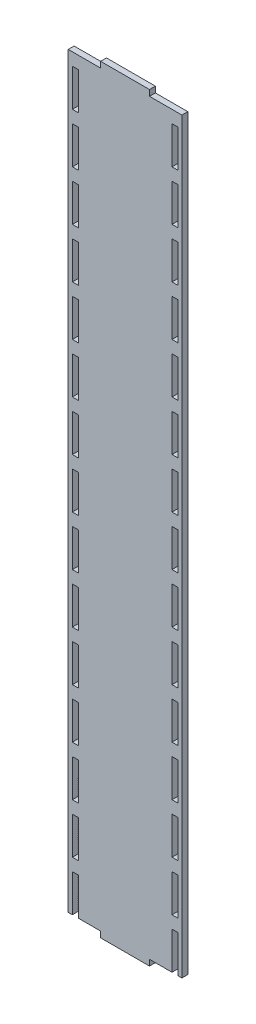
from build123d import *

# Parameters (mm, degrees)
SKETCH1_W           = 2.9972
SKETCH1_H           = 19.05
BOSS_EXTRUDE1_DEPTH = 2.9972


with BuildPart() as part:
    # Sketch1 → Boss-Extrude1 (new body)
    with BuildSketch(Plane.XY):
        Polygon((-12.4968, 0), (-12.4968, -2.9972), (-29.0068, -2.9972), (-29.0068, -383.9972), (-26.8986, -383.9972), (-26.8986, -364.9472), (-23.9014, -364.9472), (-23.9014, -383.9972), (-12.4968, -383.9972), (-12.4968, -386.9944), (12.4206, -386.9944), (12.4206, -383.9972), (23.9014, -383.9972), (23.9014, -364.9472), (26.8986, -364.9472), (26.8986, -383.9972), (28.9306, -383.9972), (28.9306, -2.9972), (12.4206, -2.9972), (12.4206, 0), align=None)
        with Locations((-25.4, -349.0722)):
            Rectangle(SKETCH1_W, SKETCH1_H, mode=Mode.SUBTRACT)
        with Locations((-25.4, -323.6722)):
            Rectangle(SKETCH1_W, SKETCH1_H, mode=Mode.SUBTRACT)
        with Locations((-25.4, -298.2722)):
            Rectangle(SKETCH1_W, SKETCH1_H, mode=Mode.SUBTRACT)
        with Locations((-25.4, -272.8722)):
            Rectangle(SKETCH1_W, SKETCH1_H, mode=Mode.SUBTRACT)
        with Locations((-25.4, -247.4722)):
            Rectangle(SKETCH1_W, SKETCH1_H, mode=Mode.SUBTRACT)
        with Locations((-25.4, -222.0722)):
            Rectangle(SKETCH1_W, SKETCH1_H, mode=Mode.SUBTRACT)
        with Locations((-25.4, -196.6722)):
            Rectangle(SKETCH1_W, SKETCH1_H, mode=Mode.SUBTRACT)
        with Locations((25.4, -349.0722)):
            Rectangle(SKETCH1_W, SKETCH1_H, mode=Mode.SUBTRACT)
        with Locations((25.4, -323.6722)):
            Rectangle(SKETCH1_W, SKETCH1_H, mode=Mode.SUBTRACT)
        with Locations((25.4, -298.2722)):
            Rectangle(SKETCH1_W, SKETCH1_H, mode=Mode.SUBTRACT)
        with Locations((25.4, -272.8722)):
            Rectangle(SKETCH1_W, SKETCH1_H, mode=Mode.SUBTRACT)
        with Locations((25.4, -247.4722)):
            Rectangle(SKETCH1_W, SKETCH1_H, mode=Mode.SUBTRACT)
        with Locations((25.4, -222.0722)):
            Rectangle(SKETCH1_W, SKETCH1_H, mode=Mode.SUBTRACT)
        with Locations((25.4, -196.6722)):
            Rectangle(SKETCH1_W, SKETCH1_H, mode=Mode.SUBTRACT)
        with Locations((-25.4, -171.2722)):
            Rectangle(SKETCH1_W, SKETCH1_H, mode=Mode.SUBTRACT)
        with Locations((-25.4, -145.8722)):
            Rectangle(SKETCH1_W, SKETCH1_H, mode=Mode.SUBTRACT)
        with Locations((-25.4, -120.4722)):
            Rectangle(SKETCH1_W, SKETCH1_H, mode=Mode.SUBTRACT)
        with Locations((-25.4, -95.0722)):
            Rectangle(SKETCH1_W, SKETCH1_H, mode=Mode.SUBTRACT)
        with Locations((-25.4, -69.6722)):
            Rectangle(SKETCH1_W, SKETCH1_H, mode=Mode.SUBTRACT)
        with Locations((-25.4, -44.2722)):
            Rectangle(SKETCH1_W, SKETCH1_H, mode=Mode.SUBTRACT)
        with Locations((-25.4, -18.8722)):
            Rectangle(SKETCH1_W, SKETCH1_H, mode=Mode.SUBTRACT)
        with Locations((25.4, -171.2722)):
            Rectangle(SKETCH1_W, SKETCH1_H, mode=Mode.SUBTRACT)
        with Locations((25.4, -145.8722)):
            Rectangle(SKETCH1_W, SKETCH1_H, mode=Mode.SUBTRACT)
        with Locations((25.4, -120.4722)):
            Rectangle(SKETCH1_W, SKETCH1_H, mode=Mode.SUBTRACT)
        with Locations((25.4, -95.0722)):
            Rectangle(SKETCH1_W, SKETCH1_H, mode=Mode.SUBTRACT)
        with Locations((25.4, -69.6722)):
            Rectangle(SKETCH1_W, SKETCH1_H, mode=Mode.SUBTRACT)
        with Locations((25.4, -44.2722)):
            Rectangle(SKETCH1_W, SKETCH1_H, mode=Mode.SUBTRACT)
        with Locations((25.4, -18.8722)):
            Rectangle(SKETCH1_W, SKETCH1_H, mode=Mode.SUBTRACT)
    extrude(amount=BOSS_EXTRUDE1_DEPTH)


solid = part.part
